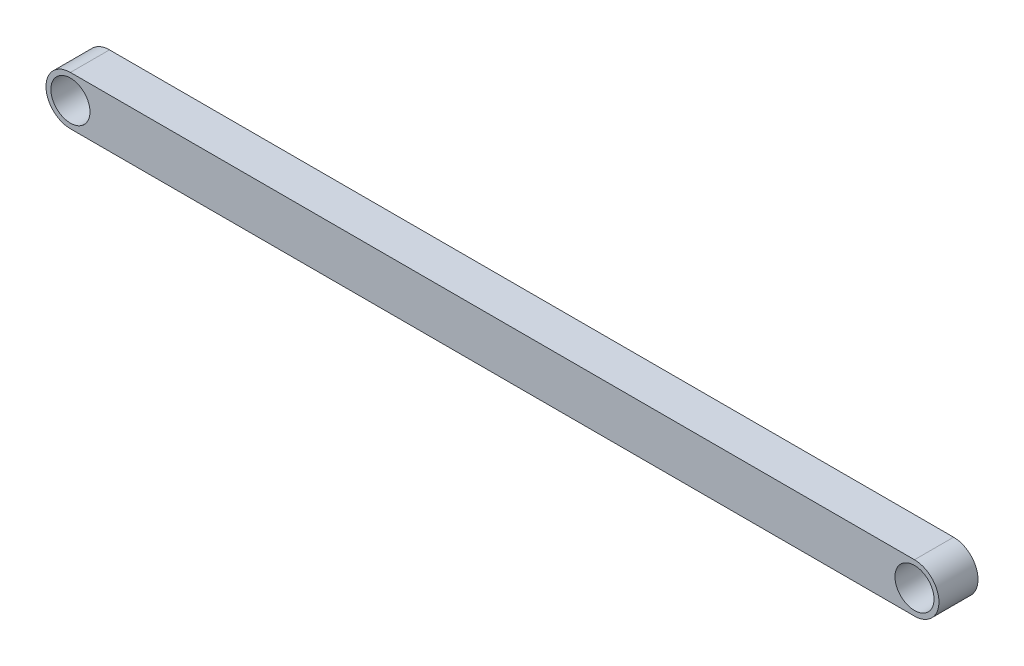
from build123d import *

# Parameters (mm, degrees)
SKETCH1_R           = 1
BOSS_EXTRUDE1_DEPTH = 2


with BuildPart() as part:
    # Sketch1 → Boss-Extrude1 (new body)
    with BuildSketch(Plane.XY):
        with BuildLine():
            Line((0, 1.25), (43.2, 1.25))
            ThreePointArc((43.2, 1.25), (44.45, 0), (43.2, -1.25))
            Line((43.2, -1.25), (0, -1.25))
            ThreePointArc((0, -1.25), (-1.25, 0), (0, 1.25))
        make_face()
        Circle(SKETCH1_R, mode=Mode.SUBTRACT)
        with Locations((43.2, 0)):
            Circle(SKETCH1_R, mode=Mode.SUBTRACT)
    extrude(amount=BOSS_EXTRUDE1_DEPTH)


solid = part.part
